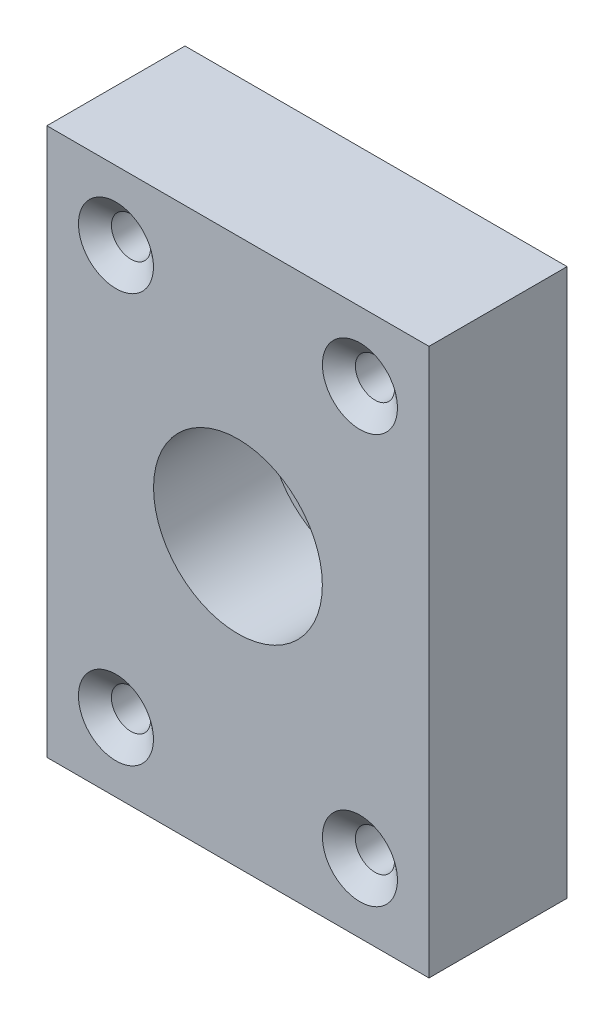
from build123d import *

# Parameters (mm, degrees)
SKETCH1_W                       = 49.8
SKETCH1_H                       = 71.3
BASE_DEPTH                      = 18
SKETCH2_R                       = 11
LEAD_NUT_INLAY_DEPTH            = 15
SKETCH3_R                       = 6.5
LEAD_SCREW_CLEARANCE_DEPTH      = 89.253781789
WOODSCREW_CLEARANCE_D           = 5.1054
WOODSCREW_CLEARANCE_CSINK_D     = 9.779
WOODSCREW_CLEARANCE_CSINK_ANGLE = 100


with BuildPart() as part:
    # Sketch1 → base (new body)
    with BuildSketch(Plane.XY):
        with Locations((24.9, 35.65)):
            Rectangle(SKETCH1_W, SKETCH1_H)
    extrude(amount=BASE_DEPTH)

    # Sketch2 → lead nut inlay (cut)
    with BuildSketch(Plane.XY.offset(18)):
        with Locations((24.9, 37.4)):
            Circle(SKETCH2_R)
    extrude(amount=-LEAD_NUT_INLAY_DEPTH, mode=Mode.SUBTRACT)

    # Sketch3 → lead screw clearance (cut, through all)
    with BuildSketch(Plane.XY.offset(3)):
        with Locations((24.9, 37.4)):
            Circle(SKETCH3_R)
    extrude(amount=-LEAD_SCREW_CLEARANCE_DEPTH, mode=Mode.SUBTRACT)

    # woodscrew clearance (through all)
    with Locations(Plane.XY.offset(18)):
        with Locations((9, 9), (40.8, 62.3), (9, 62.3), (40.8, 9)):
            CounterSinkHole(WOODSCREW_CLEARANCE_D / 2, WOODSCREW_CLEARANCE_CSINK_D / 2, counter_sink_angle=WOODSCREW_CLEARANCE_CSINK_ANGLE)


solid = part.part
